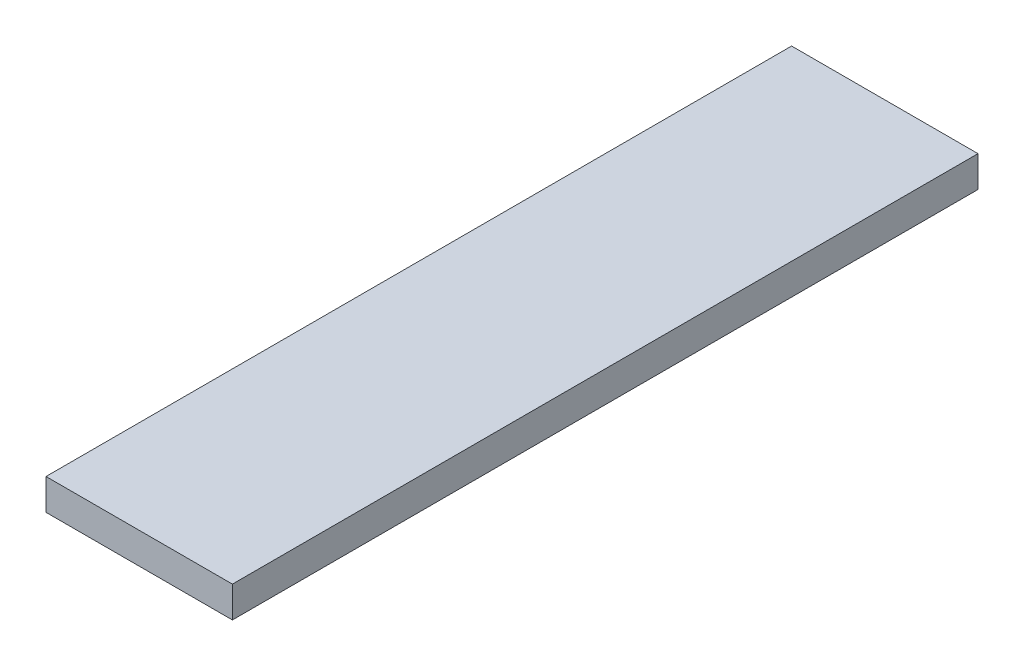
from build123d import *

# Parameters (mm, degrees)
SKETCH1_W           = 38.1
SKETCH1_H           = 152.4
BOSS_EXTRUDE1_DEPTH = 6.35


with BuildPart() as part:
    # Sketch1 → Boss-Extrude1 (new body)
    with BuildSketch(Plane(origin=(0, 0, 0), x_dir=(1, 0, 0), z_dir=(0, 1, 0))):
        Rectangle(SKETCH1_W, SKETCH1_H)
    extrude(amount=BOSS_EXTRUDE1_DEPTH)


solid = part.part
